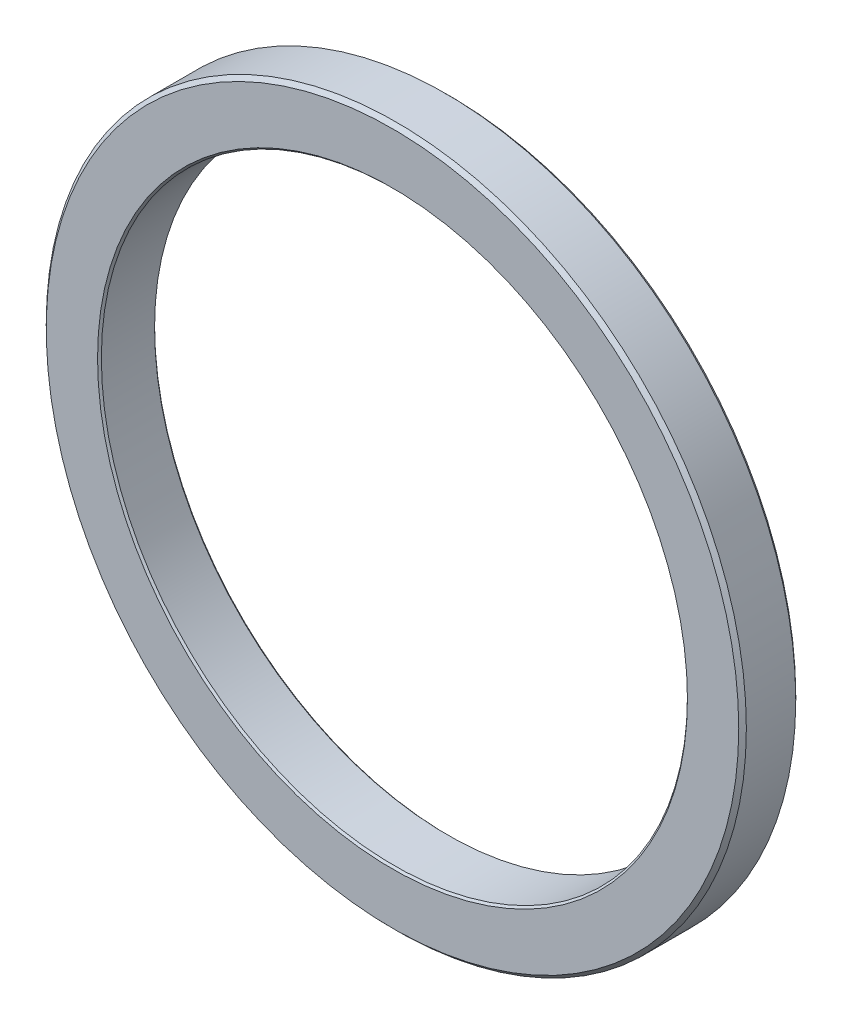
from build123d import *


with BuildPart() as part:
    # Sketch1 → Revolve1 (revolve)
    with BuildSketch(Plane(origin=(0, 0, 0), x_dir=(0, 0, -1), z_dir=(1, 0, 0)), mode=Mode.PRIVATE) as revolve1_sk:
        Polygon((0, 38.8), (0.25, 38.55), (7.25, 38.55), (7.5, 38.8), (7.5, 45.55), (7, 46.05), (0.5, 46.05), (0, 45.55), align=None)
    revolve(revolve1_sk.sketch.rotate(Axis((0, 0, 0), (0, 0, -1)), 90), axis=Axis((0, 0, 0), (0, 0, -1)))


solid = part.part
